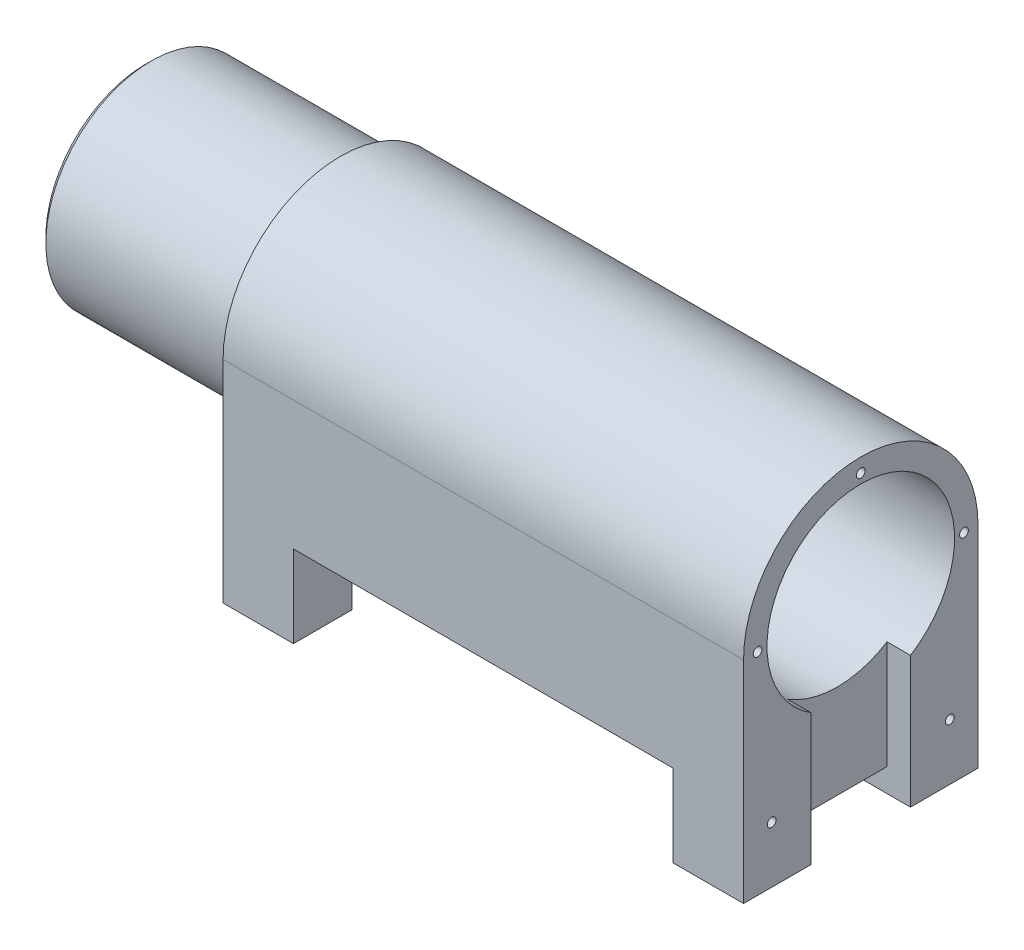
from build123d import *

# Parameters (mm, degrees)
SKETCH1_W                                         = 31.75
SKETCH1_H                                         = 44.45
BOSS_EXTRUDE1_DEPTH                               = 48.41875
CUT_EXTRUDE1_REACH                                = 102.615
SKETCH3_W                                         = 51.435
SKETCH3_H                                         = 34.925
CUT_EXTRUDE2_DEPTH                                = 11.1125
SKETCH4_W                                         = 26.3525
SKETCH4_H                                         = 31.75
CUT_EXTRUDE3_DEPTH                                = 11.1125
CUT_EXTRUDE6_START                                = -26.3525
SKETCH5_R                                         = 14.2875
CUT_EXTRUDE6_DEPTH                                = 26.3525
SKETCH6_R                                         = 12.7
CUT_EXTRUDE7_DEPTH                                = 93.0275
CHAMFER1_SIZE                                     = 0.762
SKETCH7_W                                         = 13.462
SKETCH7_H                                         = 17.805429953
CUT_EXTRUDE8_DEPTH                                = 3.175
SKETCH8_W                                         = 6.35
SKETCH8_H                                         = 13.462
CUT_EXTRUDE9_DEPTH                                = 3.175
CUT_EXTRUDE10_REACH                               = 77.592
SKETCH9_W                                         = 15.875
SKETCH9_H                                         = 9.525
FILLET1_R                                         = 3.175
SKETCH10_R                                        = 5.0038
CUT_EXTRUDE11_DEPTH                               = 101.615444422
CSK_FOR_M2_5_FLAT_HEAD_MACHINE_SCREW1_D           = 2.9
CSK_FOR_M2_5_FLAT_HEAD_MACHINE_SCREW1_CSINK_D     = 5.5
CSK_FOR_M2_5_FLAT_HEAD_MACHINE_SCREW1_CSINK_ANGLE = 90
CIRPATTERN1_COUNT                                 = 3
F_4_40_TAPPED_HOLE1_D                             = 2.2606
F_4_40_TAPPED_HOLE1_DEPTH                         = 7.62
F_4_40_TAPPED_HOLE1_TIP                           = 0.679152758
F_0_80_TAPPED_HOLE1_D                             = 1.19126
F_0_80_TAPPED_HOLE1_DEPTH                         = 6.096
F_0_80_TAPPED_HOLE1_TIP                           = 0.357890611
F_8_32_TAPPED_HOLE1_D                             = 3.4544
F_8_32_TAPPED_HOLE1_DEPTH                         = 7.112
F_8_32_TAPPED_HOLE1_TIP                           = 1.037806461


with BuildPart() as part:
    # Sketch1 → Boss-Extrude1 (new, symmetric)
    with BuildSketch(Plane(origin=(0, 0, 0), x_dir=(0, 0, -1), z_dir=(1, 0, 0))):
        Rectangle(SKETCH1_W, SKETCH1_H)
    extrude(amount=BOSS_EXTRUDE1_DEPTH, both=True)

    # Sketch2 → Cut-Extrude1 (cut, up to next)
    with BuildSketch(Plane(origin=(48.41875, 0, 0), x_dir=(0, 0, -1), z_dir=(1, 0, 0)), mode=Mode.PRIVATE) as cut_extrude1_sk1:
        with BuildLine():
            Line((-15.875, 22.225), (-15.875, 6.35))
            ThreePointArc((-15.875, 6.35), (-11.225320151, 17.575320151), (0, 22.225))
            Line((0, 22.225), (-15.875, 22.225))
        make_face()
    cut_extrude1_tool1 = extrude(cut_extrude1_sk1.sketch, amount=-CUT_EXTRUDE1_REACH, mode=Mode.PRIVATE) & part.part
    # Sketch2 → Cut-Extrude1 (cut, up to next)
    with BuildSketch(Plane(origin=(48.41875, 0, 0), x_dir=(0, 0, -1), z_dir=(1, 0, 0)), mode=Mode.PRIVATE) as cut_extrude1_sk2:
        with BuildLine():
            Line((15.875, 22.225), (0, 22.225))
            ThreePointArc((0, 22.225), (11.225320151, 17.575320151), (15.875, 6.35))
            Line((15.875, 6.35), (15.875, 22.225))
        make_face()
    cut_extrude1_tool2 = extrude(cut_extrude1_sk2.sketch, amount=-CUT_EXTRUDE1_REACH, mode=Mode.PRIVATE) & part.part
    add(cut_extrude1_tool1.solids().sort_by_distance((48.41875, 18.679034, 12.329034))[0], mode=Mode.SUBTRACT)
    add(cut_extrude1_tool2.solids().sort_by_distance((48.41875, 18.679034, -12.329034))[0], mode=Mode.SUBTRACT)

    # Sketch3 → Cut-Extrude2 (cut)
    with BuildSketch(Plane.XZ.offset(22.225)):
        with Locations((13.17625, -1.5875)):
            Rectangle(SKETCH3_W, SKETCH3_H)
    extrude(amount=-CUT_EXTRUDE2_DEPTH, mode=Mode.SUBTRACT)

    # Sketch4 → Cut-Extrude3 (cut)
    with BuildSketch(Plane.XZ.offset(22.225)):
        with Locations((-35.2425, 0)):
            Rectangle(SKETCH4_W, SKETCH4_H)
    extrude(amount=-CUT_EXTRUDE3_DEPTH, mode=Mode.SUBTRACT)

    # Sketch5 → Cut-Extrude6 (cut)
    with BuildSketch(Plane.ZY.offset(48.41875).offset(CUT_EXTRUDE6_START)):
        with BuildLine():
            Line((-15.875, -22.225), (15.875, -22.225))
            Line((15.875, -22.225), (15.875, 6.35))
            ThreePointArc((15.875, 6.35), (0, 22.225), (-15.875, 6.35))
            Line((-15.875, 6.35), (-15.875, -22.225))
        make_face()
        with Locations((0, 6.35)):
            Circle(SKETCH5_R, mode=Mode.SUBTRACT)
    extrude(amount=CUT_EXTRUDE6_DEPTH, mode=Mode.SUBTRACT)

    # Sketch6 → Cut-Extrude7 (cut)
    with BuildSketch(Plane(origin=(48.41875, 0, 0), x_dir=(0, 0, -1), z_dir=(1, 0, 0))):
        with Locations((0, 6.35)):
            Circle(SKETCH6_R)
    extrude(amount=-CUT_EXTRUDE7_DEPTH, mode=Mode.SUBTRACT)

    # Chamfer1
    chamfer1_edges = [part.edges().sort_by_distance(p)[0] for p in [
        (-48.41875, 6.35, -14.2875),
    ]]
    chamfer(chamfer1_edges, length=CHAMFER1_SIZE)

    # Sketch7 → Cut-Extrude8 (cut)
    with BuildSketch(Plane(origin=(48.41875, 0, 0), x_dir=(0, 0, -1), z_dir=(1, 0, 0))):
        with Locations((0, -13.322285024)):
            Rectangle(SKETCH7_W, SKETCH7_H)
    extrude(amount=-CUT_EXTRUDE8_DEPTH, mode=Mode.SUBTRACT)

    # Sketch8 → Cut-Extrude9 (cut)
    with BuildSketch(Plane.XZ.offset(22.225)):
        with Locations((42.06875, 0)):
            Rectangle(SKETCH8_W, SKETCH8_H)
    extrude(amount=-CUT_EXTRUDE9_DEPTH, mode=Mode.SUBTRACT)

    # Sketch9 → Cut-Extrude10 (cut, up to next)
    with BuildSketch(Plane.ZY.offset(22.06625), mode=Mode.PRIVATE) as cut_extrude10_sk1:
        with Locations((0, -17.4625)):
            Rectangle(SKETCH9_W, SKETCH9_H)
    cut_extrude10_tool1 = extrude(cut_extrude10_sk1.sketch, amount=-CUT_EXTRUDE10_REACH, mode=Mode.PRIVATE) & part.part
    add(cut_extrude10_tool1.solids().sort_by_distance((-22.06625, -17.4625, 0))[0], mode=Mode.SUBTRACT)

    # Fillet1
    fillet1_edges = [part.edges().sort_by_distance(p)[0] for p in [
        (-17.30375, -12.7, 7.9375),
        (-17.30375, -12.7, -7.9375),
    ]]
    fillet(fillet1_edges, radius=FILLET1_R)

    # Sketch10 → Cut-Extrude11 (cut, through all)
    with BuildSketch(Plane.ZY.offset(48.41875)):
        with Locations((0, 6.35)):
            Circle(SKETCH10_R)
    extrude(amount=-CUT_EXTRUDE11_DEPTH, mode=Mode.SUBTRACT)

    # CSK for M2.5 Flat Head Machine Screw1 (through all)
    with Locations(Plane.ZY.offset(48.41875)):
        with Locations((-2.394141003, -0.227848346)):
            csk_for_m2_5_flat_head_machine_screw1 = CounterSinkHole(CSK_FOR_M2_5_FLAT_HEAD_MACHINE_SCREW1_D / 2, CSK_FOR_M2_5_FLAT_HEAD_MACHINE_SCREW1_CSINK_D / 2, counter_sink_angle=CSK_FOR_M2_5_FLAT_HEAD_MACHINE_SCREW1_CSINK_ANGLE)

    # CirPattern1: CSK for M2.5 Flat Head Machine Screw1 ×3 about axis
    cirpattern1_axis = Axis((0, 6.35, 0), (1, 0, 0))
    for i in range(1, CIRPATTERN1_COUNT):
        add(csk_for_m2_5_flat_head_machine_screw1.rotate(cirpattern1_axis, i * 360 / CIRPATTERN1_COUNT), mode=Mode.SUBTRACT)

    # #4-40 Tapped Hole1
    with Locations(Plane.ZY.offset(22.06625)):
        with Locations((-13.335, -12.065), (13.335, -12.065)):
            Hole(F_4_40_TAPPED_HOLE1_D / 2, depth=F_4_40_TAPPED_HOLE1_DEPTH)
            with Locations((0, 0, -(F_4_40_TAPPED_HOLE1_DEPTH + F_4_40_TAPPED_HOLE1_TIP / 2))):  # 118° drill point
                Cone(0, F_4_40_TAPPED_HOLE1_D / 2, F_4_40_TAPPED_HOLE1_TIP, mode=Mode.SUBTRACT)

    # #0-80 Tapped Hole1
    with Locations(Plane(origin=(48.41875, 0, 0), x_dir=(0, 0, -1), z_dir=(1, 0, 0))):
        with Locations((-12.065, -14.605), (12.065, -14.605), (0, 20.32), (-13.97, 6.35), (13.97, 6.35)):
            Hole(F_0_80_TAPPED_HOLE1_D / 2, depth=F_0_80_TAPPED_HOLE1_DEPTH)
            with Locations((0, 0, -(F_0_80_TAPPED_HOLE1_DEPTH + F_0_80_TAPPED_HOLE1_TIP / 2))):  # 118° drill point
                Cone(0, F_0_80_TAPPED_HOLE1_D / 2, F_0_80_TAPPED_HOLE1_TIP, mode=Mode.SUBTRACT)

    # #8-32 Tapped Hole1
    with Locations(Plane.XZ.offset(22.225)):
        with Locations((-17.30375, 11.90625), (43.65625, 11.90625), (-17.30375, -11.90625), (43.65625, -11.90625)):
            Hole(F_8_32_TAPPED_HOLE1_D / 2, depth=F_8_32_TAPPED_HOLE1_DEPTH)
            with Locations((0, 0, -(F_8_32_TAPPED_HOLE1_DEPTH + F_8_32_TAPPED_HOLE1_TIP / 2))):  # 118° drill point
                Cone(0, F_8_32_TAPPED_HOLE1_D / 2, F_8_32_TAPPED_HOLE1_TIP, mode=Mode.SUBTRACT)


solid = part.part
